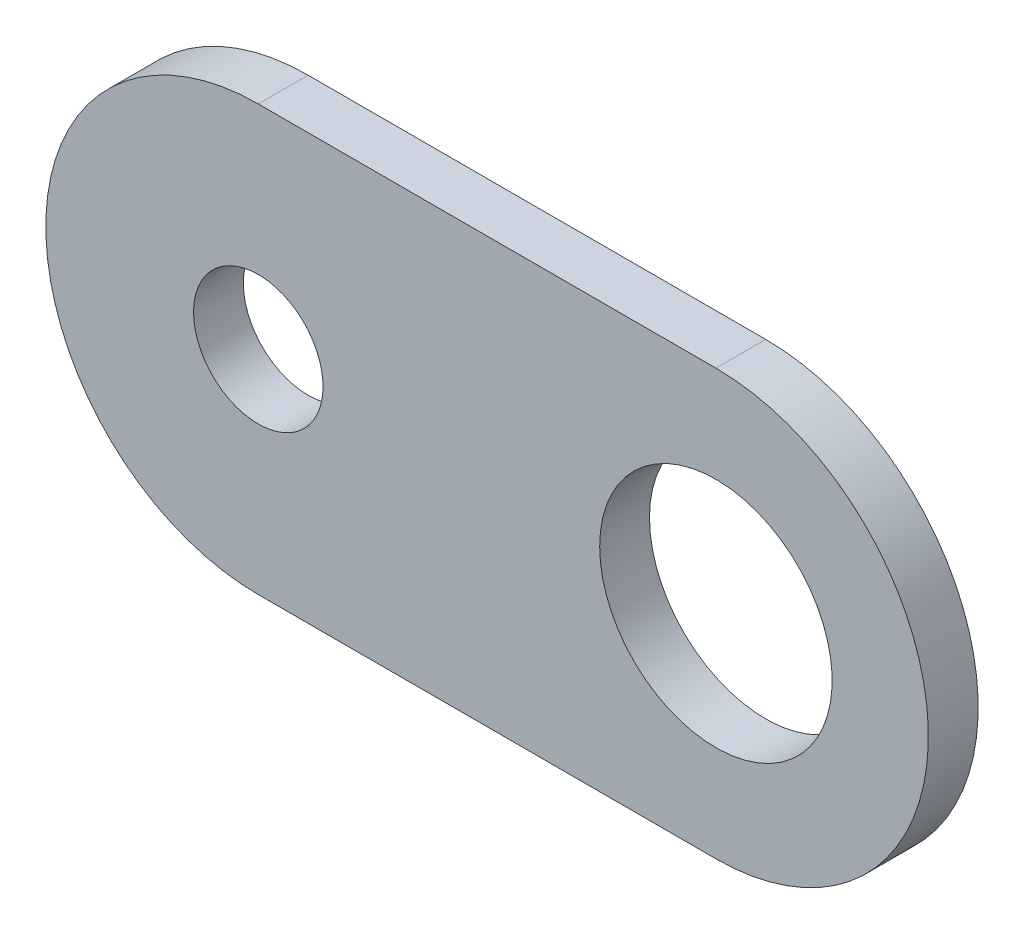
from build123d import *

# Parameters (mm, degrees)
SKETCH1_R           = 4.953
SKETCH1_R_2         = 8.89
BOSS_EXTRUDE1_DEPTH = 3.81


with BuildPart() as part:
    # Sketch1 → Boss-Extrude1 (new body)
    with BuildSketch(Plane.XY):
        with BuildLine():
            Line((-17.5, 16.250000012), (17.5, 16.250000012))
            ThreePointArc((17.5, 16.250000012), (33.750000012, 0), (17.5, -16.250000012))
            Line((17.5, -16.250000012), (-17.5, -16.250000012))
            ThreePointArc((-17.5, -16.250000012), (-33.750000012, 0), (-17.5, 16.250000012))
        make_face()
        with Locations(Location((-17.5, 0, 0), (0, 0, 180))):
            Circle(SKETCH1_R, mode=Mode.SUBTRACT)
        with Locations(Location((17.5, 0, 0), (0, 0, 180))):
            Circle(SKETCH1_R_2, mode=Mode.SUBTRACT)
    extrude(amount=BOSS_EXTRUDE1_DEPTH)


solid = part.part
